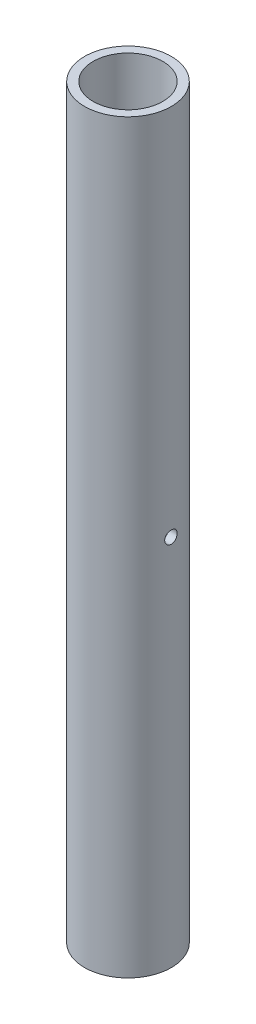
from build123d import *

# Parameters (mm, degrees)
SKETCH2_R                   = 17.45
SKETCH2_R_2                 = 14
BOSS_EXTRUDE1_DEPTH         = 300
TAP_DRILL_FOR_M6X1_0_TAP2_D = 5


with BuildPart() as part:
    # Sketch2 → Boss-Extrude1 (new body)
    with BuildSketch(Plane(origin=(0, 0, 0), x_dir=(1, 0, 0), z_dir=(0, 1, 0))):
        with Locations(Location((0, 0, 0), (0, 0, 270))):
            Circle(SKETCH2_R)
        with Locations(Location((0, 0, 0), (0, 0, 270))):
            Circle(SKETCH2_R_2, mode=Mode.SUBTRACT)
    extrude(amount=-BOSS_EXTRUDE1_DEPTH)

    # Tap Drill for M6x1.0 Tap2 (through all)
    with Locations(Plane(origin=(17.45, 0, 0), x_dir=(0, 0, -1), z_dir=(1, 0, 0))):
        with Locations((0, -150)):
            Hole(TAP_DRILL_FOR_M6X1_0_TAP2_D / 2)


solid = part.part
